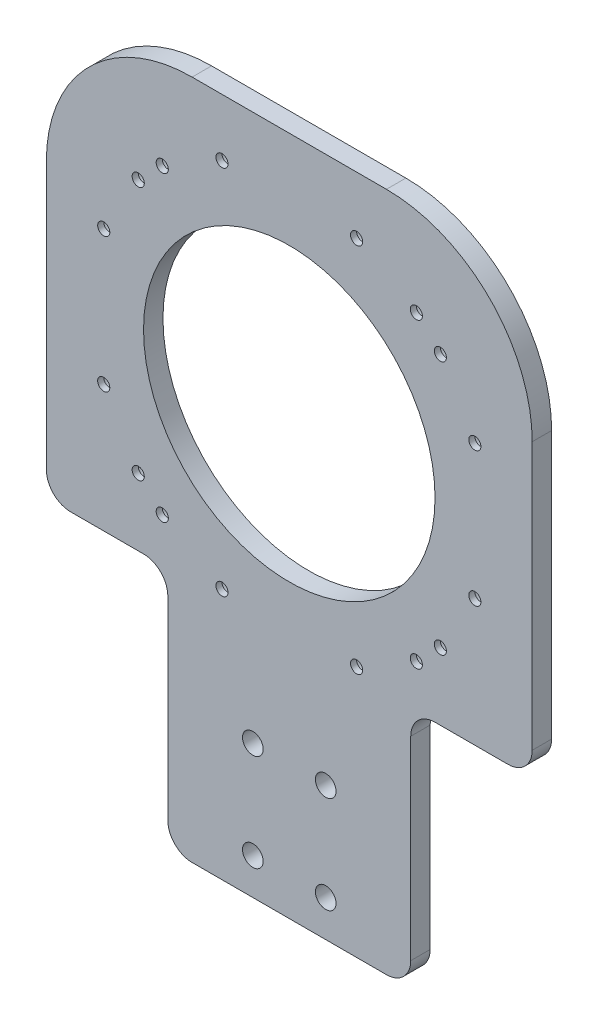
from build123d import *

# Parameters (mm, degrees)
SKETCH_1_W          = 200
SKETCH_1_H          = 400
EXTRUDE_1_DEPTH     = 8
SKETCH_2_R          = 60
CUT_EXTRUDE_1_DEPTH = 10
FILLET_1_R          = 60
SKETCH_5_R          = 4.25
CUT_EXTRUDE_4_DEPTH = 10
SKETCH_6_W          = 50
SKETCH_6_H          = 220
CUT_EXTRUDE_5_DEPTH = 10
FILLET_2_R          = 10
SKETCH_7_R          = 2.5
CUT_EXTRUDE_6_DEPTH = 69
SKETCH_8_R          = 6
CUT_EXTRUDE_7_DEPTH = 5.5
SKETCH_9_W          = 100
SKETCH_9_H          = 120
CUT_EXTRUDE_8_DEPTH = 10
FILLET_3_R          = 10


with BuildPart() as part:
    # 草图1 → 凸台-拉伸1 (new body)
    with BuildSketch(Plane.XY):
        with Locations((0, 200)):
            Rectangle(SKETCH_1_W, SKETCH_1_H)
    extrude(amount=EXTRUDE_1_DEPTH)

    # 草图2 → 切除-拉伸1 (cut)
    with BuildSketch(Plane(origin=(0, 0, 0), x_dir=(-1, 0, 0), z_dir=(0, 0, -1))):
        with Locations((0, 300)):
            Circle(SKETCH_2_R)
    extrude(amount=-CUT_EXTRUDE_1_DEPTH, mode=Mode.SUBTRACT)

    # 圆角1
    fillet_1_edges = [part.edges().sort_by_distance(p)[0] for p in [
        (100, 400, 4),
        (-100, 400, 4),
    ]]
    fillet(fillet_1_edges, radius=FILLET_1_R)

    # 草图5 → 切除-拉伸4 (cut)
    with BuildSketch(Plane(origin=(0, 0, 0), x_dir=(-1, 0, 0), z_dir=(0, 0, -1))):
        with Locations((-15, 25)):
            Circle(SKETCH_5_R)
        with Locations((15, 25)):
            Circle(SKETCH_5_R)
        with Locations((-15, 65)):
            Circle(SKETCH_5_R)
        with Locations((15, 65)):
            Circle(SKETCH_5_R)
        with Locations((-15, 175)):
            Circle(SKETCH_5_R)
        with Locations((15, 135)):
            Circle(SKETCH_5_R)
        with Locations((-15, 135)):
            Circle(SKETCH_5_R)
        with Locations((15, 175)):
            Circle(SKETCH_5_R)
    extrude(amount=-CUT_EXTRUDE_4_DEPTH, mode=Mode.SUBTRACT)

    # 草图6 → 切除-拉伸5 (cut)
    with BuildSketch(Plane(origin=(0, 0, 0), x_dir=(-1, 0, 0), z_dir=(0, 0, -1))):
        with Locations((75, 110)):
            Rectangle(SKETCH_6_W, SKETCH_6_H)
        with Locations((-75, 110)):
            Rectangle(SKETCH_6_W, SKETCH_6_H)
    extrude(amount=-CUT_EXTRUDE_5_DEPTH, mode=Mode.SUBTRACT)

    # 圆角2
    fillet_2_edges = [part.edges().sort_by_distance(p)[0] for p in [
        (-100, 220, 4),
        (-50, 220, 4),
        (100, 220, 4),
        (50, 220, 4),
    ]]
    fillet(fillet_2_edges, radius=FILLET_2_R)

    # 草图7 → 切除-拉伸6 (cut)
    with BuildSketch(Plane(origin=(0, 0, 0), x_dir=(-1, 0, 0), z_dir=(0, 0, -1))):
        with Locations((27.706208015, 376.380158009)):
            Circle(SKETCH_7_R)
        with Locations((52.294053173, 362.184358988)):
            Circle(SKETCH_7_R)
        with Locations((62.184358988, 352.294053173)):
            Circle(SKETCH_7_R)
        with Locations((76.380158009, 327.706208015)):
            Circle(SKETCH_7_R)
        with Locations((76.380158009, 272.293791985)):
            Circle(SKETCH_7_R)
        with Locations((62.184358988, 247.705946827)):
            Circle(SKETCH_7_R)
        with Locations((52.294053173, 237.815641012)):
            Circle(SKETCH_7_R)
        with Locations((27.706208015, 223.619841991)):
            Circle(SKETCH_7_R)
        with Locations((-27.706208015, 223.619841991)):
            Circle(SKETCH_7_R)
        with Locations((-52.294053173, 237.815641012)):
            Circle(SKETCH_7_R)
        with Locations((-62.184358988, 247.705946827)):
            Circle(SKETCH_7_R)
        with Locations((-76.380158009, 272.293791985)):
            Circle(SKETCH_7_R)
        with Locations((-76.380158009, 327.706208015)):
            Circle(SKETCH_7_R)
        with Locations((-62.184358988, 352.294053173)):
            Circle(SKETCH_7_R)
        with Locations((-52.294053173, 362.184358988)):
            Circle(SKETCH_7_R)
        with Locations((-27.706208015, 376.380158009)):
            Circle(SKETCH_7_R)
    extrude(amount=-CUT_EXTRUDE_6_DEPTH, mode=Mode.SUBTRACT)

    # 草图8 → 切除-拉伸7 (cut)
    with BuildSketch(Plane(origin=(0, 0, 0), x_dir=(-1, 0, 0), z_dir=(0, 0, -1))):
        with Locations((27.706208015, 376.380158009)):
            Circle(SKETCH_8_R)
        with Locations((52.294053173, 362.184358988)):
            Circle(SKETCH_8_R)
        with Locations((62.184358988, 352.294053173)):
            Circle(SKETCH_8_R)
        with Locations((76.380158009, 327.706208015)):
            Circle(SKETCH_8_R)
        with Locations((76.380158009, 272.293791985)):
            Circle(SKETCH_8_R)
        with Locations((62.184358988, 247.705946827)):
            Circle(SKETCH_8_R)
        with Locations((52.294053173, 237.815641012)):
            Circle(SKETCH_8_R)
        with Locations((27.706208015, 223.619841991)):
            Circle(SKETCH_8_R)
        with Locations((-27.706208015, 223.619841991)):
            Circle(SKETCH_8_R)
        with Locations((-52.294053173, 237.815641012)):
            Circle(SKETCH_8_R)
        with Locations((-62.184358988, 247.705946827)):
            Circle(SKETCH_8_R)
        with Locations((-76.380158009, 272.293791985)):
            Circle(SKETCH_8_R)
        with Locations((-76.380158009, 327.706208015)):
            Circle(SKETCH_8_R)
        with Locations((-62.184358988, 352.294053173)):
            Circle(SKETCH_8_R)
        with Locations((-52.294053173, 362.184358988)):
            Circle(SKETCH_8_R)
        with Locations((-27.706208015, 376.380158009)):
            Circle(SKETCH_8_R)
    extrude(amount=-CUT_EXTRUDE_7_DEPTH, mode=Mode.SUBTRACT)

    # 草图9 → 切除-拉伸8 (cut)
    with BuildSketch(Plane(origin=(0, 0, 0), x_dir=(-1, 0, 0), z_dir=(0, 0, -1))):
        with Locations((0, 60)):
            Rectangle(SKETCH_9_W, SKETCH_9_H)
    extrude(amount=-CUT_EXTRUDE_8_DEPTH, mode=Mode.SUBTRACT)

    # 圆角3
    fillet_3_edges = [part.edges().sort_by_distance(p)[0] for p in [
        (-50, 120, 4),
        (50, 120, 4),
    ]]
    fillet(fillet_3_edges, radius=FILLET_3_R)


solid = part.part
